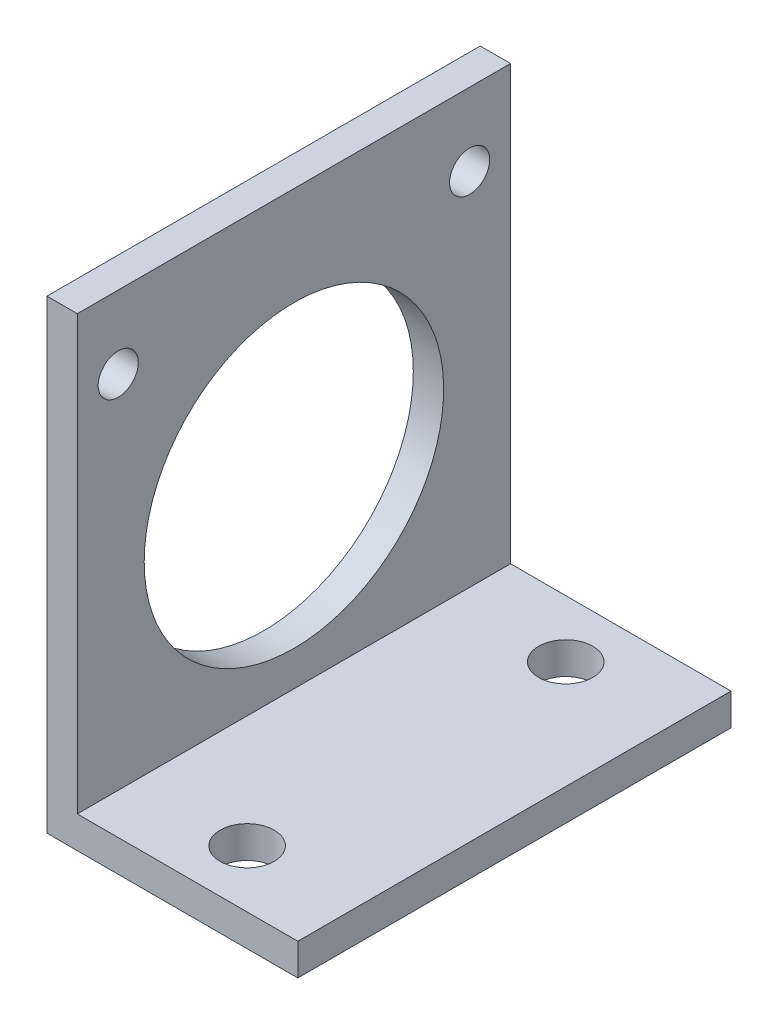
from build123d import *

# Parameters (mm, degrees)
SKETCH1_W           = 68
SKETCH1_H           = 39.37
SKETCH1_R           = 4.25
BOSS_EXTRUDE1_DEPTH = 5
SKETCH2_W           = 68
SKETCH2_H           = 4.7625
BOSS_EXTRUDE2_DEPTH = 68
SKETCH4_R           = 3.15
CUT_EXTRUDE2_DEPTH  = 88.650893072
SKETCH14_R          = 23.5
CUT_EXTRUDE3_DEPTH  = 90.638144224


with BuildPart() as part:
    # Sketch1 → Boss-Extrude1 (new body)
    with BuildSketch(Plane(origin=(0, 0, 0), x_dir=(0, 0, -1), z_dir=(0, 1, 0))):
        Rectangle(SKETCH1_W, SKETCH1_H)
        with Locations((-25, -2.735)):
            Circle(SKETCH1_R, mode=Mode.SUBTRACT)
        with Locations((25, -2.735)):
            Circle(SKETCH1_R, mode=Mode.SUBTRACT)
    extrude(amount=BOSS_EXTRUDE1_DEPTH)

    # Sketch2 → Boss-Extrude2 (add)
    with BuildSketch(Plane(origin=(0, 5, 0), x_dir=(0, 0, -1), z_dir=(0, 1, 0))):
        with Locations((0, 17.30375)):
            Rectangle(SKETCH2_W, SKETCH2_H)
    extrude(amount=BOSS_EXTRUDE2_DEPTH)

    # Sketch4 → Cut-Extrude2 (cut, through all)
    with BuildSketch(Plane(origin=(-14.9225, 0, 0), x_dir=(0, 0, -1), z_dir=(1, 0, 0))):
        with Locations((-27.577164466, 61.577164466)):
            Circle(SKETCH4_R)
        with Locations((27.577164466, 61.577164466)):
            Circle(SKETCH4_R)
    extrude(amount=-CUT_EXTRUDE2_DEPTH, mode=Mode.SUBTRACT)

    # Sketch14 → Cut-Extrude3 (cut, through all)
    with BuildSketch(Plane.ZY.offset(19.685)):
        with Locations((0, 34)):
            Circle(SKETCH14_R)
    extrude(amount=-CUT_EXTRUDE3_DEPTH, mode=Mode.SUBTRACT)


solid = part.part
